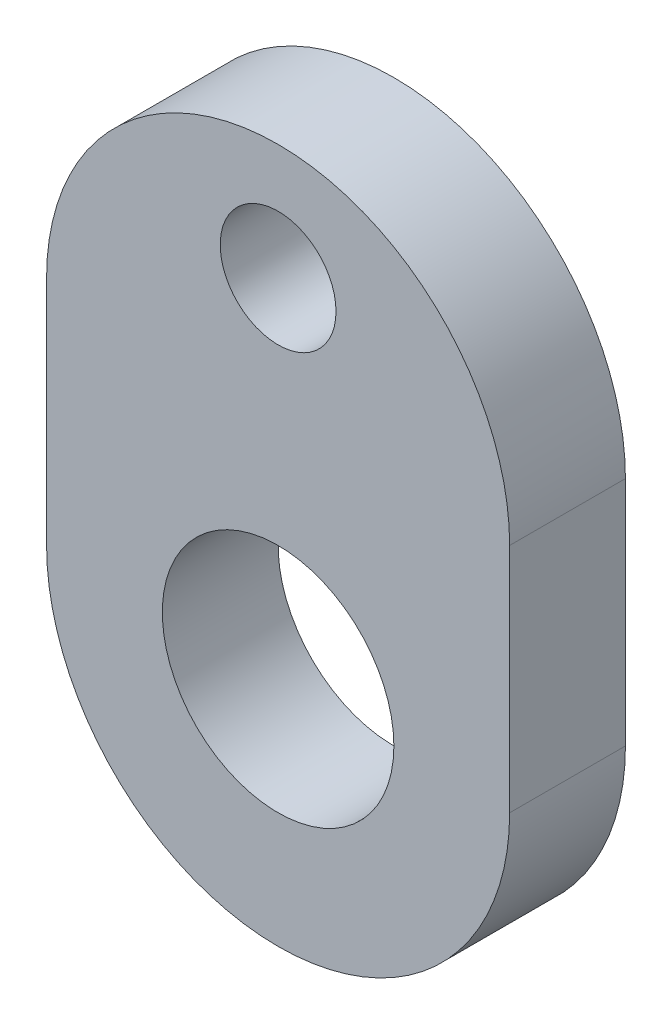
from build123d import *

# Parameters (mm, degrees)
SKETCH2_R           = 6.35
SKETCH2_R_2         = 3.175
BOSS_EXTRUDE1_DEPTH = 6.35


with BuildPart() as part:
    # Sketch2 → Boss-Extrude1 (new body)
    with BuildSketch(Plane.XY):
        with BuildLine():
            Line((-12.7, 0), (-12.7, 12.7))
            ThreePointArc((-12.7, 12.7), (0, 25.4), (12.7, 12.7))
            Line((12.7, 12.7), (12.7, 0))
            ThreePointArc((12.7, 0), (0, -12.7), (-12.7, 0))
        make_face()
        Circle(SKETCH2_R, mode=Mode.SUBTRACT)
        with Locations((0, 19.05)):
            Circle(SKETCH2_R_2, mode=Mode.SUBTRACT)
    extrude(amount=BOSS_EXTRUDE1_DEPTH)


solid = part.part
